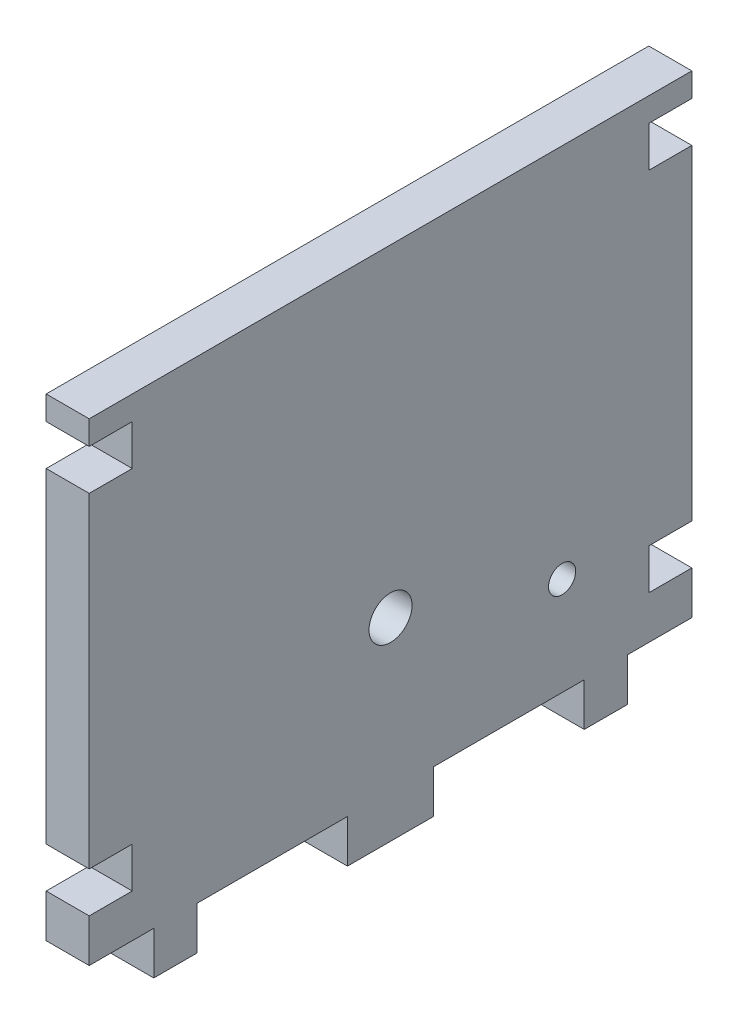
from build123d import *

# Parameters (mm, degrees)
SKETCH1_R           = 2
SKETCH1_R_2         = 3.175
BOSS_EXTRUDE1_DEPTH = 6.35


with BuildPart() as part:
    # Sketch1 → Boss-Extrude1 (new body)
    with BuildSketch(Plane(origin=(0, 0, 0), x_dir=(0, 0, -1), z_dir=(1, 0, 0))):
        Polygon((28.575, -22.225), (28.575, -28.575), (34.925, -28.575), (34.925, -22.225), (44.45, -22.225), (44.45, -15.875), (38.1, -15.875), (38.1, -9.8806), (44.45, -9.8806), (44.45, 38.1), (38.1, 38.1), (38.1, 44.0944), (44.45, 44.0944), (44.45, 47.625), (-44.45, 47.625), (-44.45, 44.0944), (-38.1, 44.0944), (-38.1, 38.1), (-44.45, 38.1), (-44.45, 22.225), (-44.45, -9.8806), (-38.1, -9.8806), (-38.1, -15.875), (-44.45, -15.875), (-44.45, -22.225), (-34.925, -22.225), (-34.925, -28.575), (-28.575, -28.575), (-28.575, -22.225), (-6.35, -22.225), (-6.35, -28.575), (6.35, -28.575), (6.35, -22.225), align=None)
        with Locations((25.309068, -7.724902)):
            Circle(SKETCH1_R, mode=Mode.SUBTRACT)
        Circle(SKETCH1_R_2, mode=Mode.SUBTRACT)
    extrude(amount=BOSS_EXTRUDE1_DEPTH)


solid = part.part
